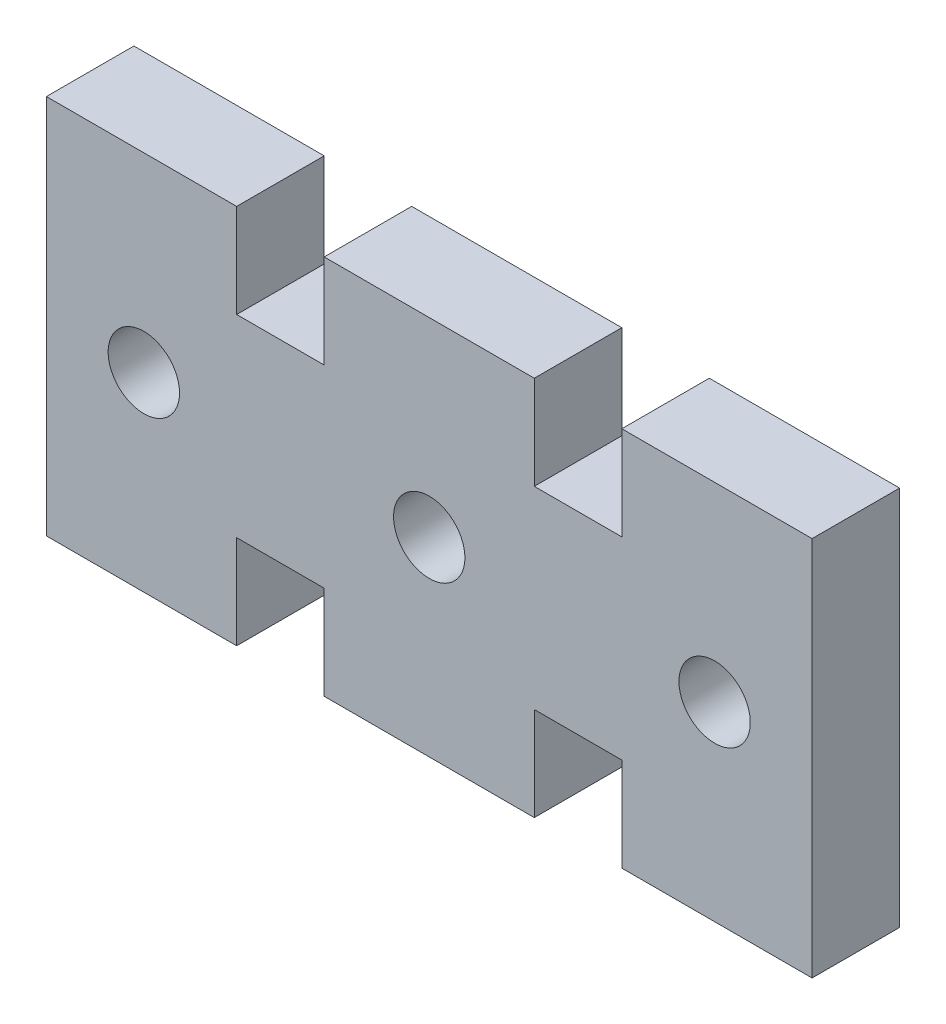
from build123d import *

# Parameters (mm, degrees)
SKETCH1_R           = 2.38125
BOSS_EXTRUDE1_DEPTH = 5.842


with BuildPart() as part:
    # Sketch1 → Boss-Extrude1 (new body)
    with BuildSketch(Plane.XY):
        Polygon((25.5540002, -12.7), (12.8540002, -12.7), (12.8540002, -6.45), (7.0120002, -6.45), (7.0120002, -12.7), (-7.0120002, -12.7), (-7.0120002, -6.45), (-12.8540002, -6.45), (-12.8540002, -12.7), (-25.5540002, -12.7), (-25.5540002, 12.7), (-12.8540002, 12.7), (-12.8540002, 6.45), (-7.0120002, 6.45), (-7.0120002, 12.7), (7.0120002, 12.7), (7.0120002, 6.45), (12.8540002, 6.45), (12.8540002, 12.7), (25.5540002, 12.7), align=None)
        Circle(SKETCH1_R, mode=Mode.SUBTRACT)
        with Locations((-19.05, 0)):
            Circle(SKETCH1_R, mode=Mode.SUBTRACT)
        with Locations(Location((19.05, 0, 0), (0, 0, 180))):
            Circle(SKETCH1_R, mode=Mode.SUBTRACT)
    extrude(amount=BOSS_EXTRUDE1_DEPTH)


solid = part.part
